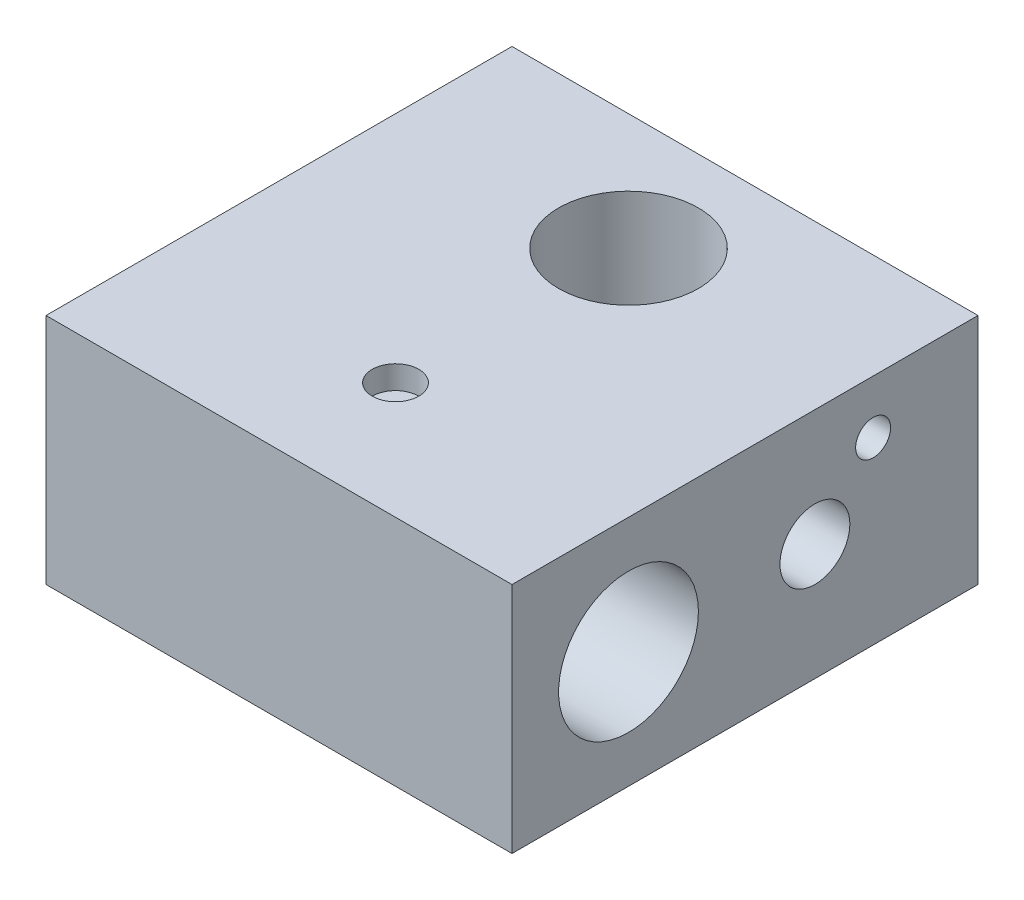
from build123d import *

# Parameters (mm, degrees)
SKETCH1_W           = 20
SKETCH1_H           = 10
BOSS_EXTRUDE1_DEPTH = 20
SKETCH3_R           = 3
CUT_EXTRUDE1_DEPTH  = 10
SKETCH4_R           = 1
CUT_EXTRUDE2_DEPTH  = 1
SKETCH7_R           = 3
CUT_EXTRUDE10_DEPTH = 20
SKETCH8_R           = 1.5
SKETCH8_R_2         = 0.75
CUT_EXTRUDE11_DEPTH = 4


with BuildPart() as part:
    # Sketch1 → Boss-Extrude1 (new body)
    with BuildSketch(Plane.XY):
        Rectangle(SKETCH1_W, SKETCH1_H)
    extrude(amount=BOSS_EXTRUDE1_DEPTH)

    # Sketch3 → Cut-Extrude1 (cut)
    with BuildSketch(Plane(origin=(0, 5, 0), x_dir=(1, 0, 0), z_dir=(0, 1, 0))):
        with Locations(Location((0, -5, 0), (0, 0, 270))):
            Circle(SKETCH3_R)
    extrude(amount=-CUT_EXTRUDE1_DEPTH, mode=Mode.SUBTRACT)

    # Sketch4 → Cut-Extrude2 (cut)
    with BuildSketch(Plane(origin=(0, 5, 0), x_dir=(1, 0, 0), z_dir=(0, 1, 0))):
        with Locations(Location((0, -15, 0), (0, 0, 270))):
            Circle(SKETCH4_R)
    extrude(amount=-CUT_EXTRUDE2_DEPTH, mode=Mode.SUBTRACT)

    # Sketch7 → Cut-Extrude10 (cut)
    with BuildSketch(Plane(origin=(10, 0, 0), x_dir=(0, 0, -1), z_dir=(1, 0, 0))):
        with Locations((-15, 0)):
            Circle(SKETCH7_R)
    extrude(amount=-CUT_EXTRUDE10_DEPTH, mode=Mode.SUBTRACT)

    # Sketch8 → Cut-Extrude11 (cut)
    with BuildSketch(Plane(origin=(10, 0, 0), x_dir=(0, 0, -1), z_dir=(1, 0, 0))):
        with Locations((-7, 0)):
            Circle(SKETCH8_R)
        with Locations((-4.501923946, 2.710056555)):
            Circle(SKETCH8_R_2)
    extrude(amount=-CUT_EXTRUDE11_DEPTH, mode=Mode.SUBTRACT)


solid = part.part
